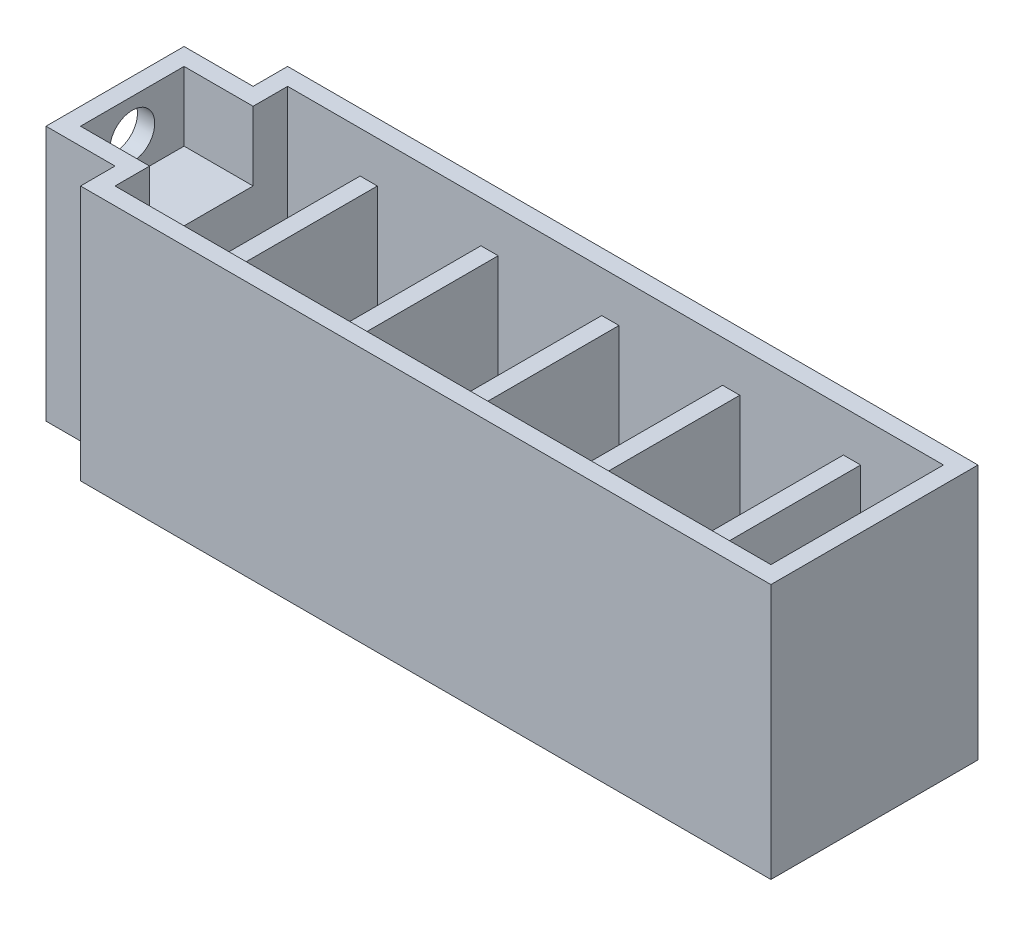
from build123d import *

# Parameters (mm, degrees)
EXTRUDE_2_DEPTH     = 1
EXTRUDE_3_DEPTH     = 37
SKETCH_3_W          = 2.5
SKETCH_3_H          = 25
EXTRUDE_4_DEPTH     = 30
SKETCH_4_W          = 10
SKETCH_4_H          = 15
EXTRUDE_5_DEPTH     = 26
CUT_EXTRUDE_1_REACH = 119.021
SKETCH_5_R          = 3.25


with BuildPart() as part:
    # 草图2 → 凸台-拉伸2 (new body)
    with BuildSketch(Plane(origin=(0, 0, 0), x_dir=(1, 0, 0), z_dir=(0, 1, 0))):
        Polygon((110, 15), (10, 15), (10, 10), (0, 10), (0, -10), (10, -10), (10, -15), (110, -15), align=None)
    extrude(amount=EXTRUDE_2_DEPTH)

    # 草图2<3> → 凸台-拉伸3 (add)
    with BuildSketch(Plane(origin=(0, 0, 0), x_dir=(1, 0, 0), z_dir=(0, 1, 0))):
        Polygon((10, 15), (10, 10), (0, 10), (0, -10), (10, -10), (10, -15), (110, -15), (110, 15), align=None)
        Polygon((12.5, 12.5), (107.5, 12.5), (107.5, -12.5), (12.5, -12.5), (12.5, -7.5), (2.5, -7.5), (2.5, 7.5), (12.5, 7.5), align=None, mode=Mode.SUBTRACT)
    extrude(amount=EXTRUDE_3_DEPTH)

    # 草图3 → 凸台-拉伸4 (add)
    with BuildSketch(Plane(origin=(0, 1, 0), x_dir=(1, 0, 0), z_dir=(0, 1, 0))):
        with Locations((24.25, 0)):
            Rectangle(SKETCH_3_W, SKETCH_3_H)
        with Locations((41.75, 0)):
            Rectangle(SKETCH_3_W, SKETCH_3_H)
        with Locations((59.25, 0)):
            Rectangle(SKETCH_3_W, SKETCH_3_H)
        with Locations((76.75, 0)):
            Rectangle(SKETCH_3_W, SKETCH_3_H)
        with Locations((94.25, 0)):
            Rectangle(SKETCH_3_W, SKETCH_3_H)
    extrude(amount=EXTRUDE_4_DEPTH)

    # 草图4 → 凸台-拉伸5 (add)
    with BuildSketch(Plane(origin=(0, 1, 0), x_dir=(1, 0, 0), z_dir=(0, 1, 0))):
        with Locations((7.5, 0)):
            Rectangle(SKETCH_4_W, SKETCH_4_H)
    extrude(amount=EXTRUDE_5_DEPTH)

    # 草图5 → 切除-拉伸1 (cut, up to next)
    with BuildSketch(Plane.ZY, mode=Mode.PRIVATE) as cut_extrude_1_sk1:
        with Locations((0, 32)):
            Circle(SKETCH_5_R)
    cut_extrude_1_tool1 = extrude(cut_extrude_1_sk1.sketch, amount=-CUT_EXTRUDE_1_REACH, mode=Mode.PRIVATE) & part.part
    add(cut_extrude_1_tool1.solids().sort_by_distance((0, 32, 0))[0], mode=Mode.SUBTRACT)


solid = part.part
